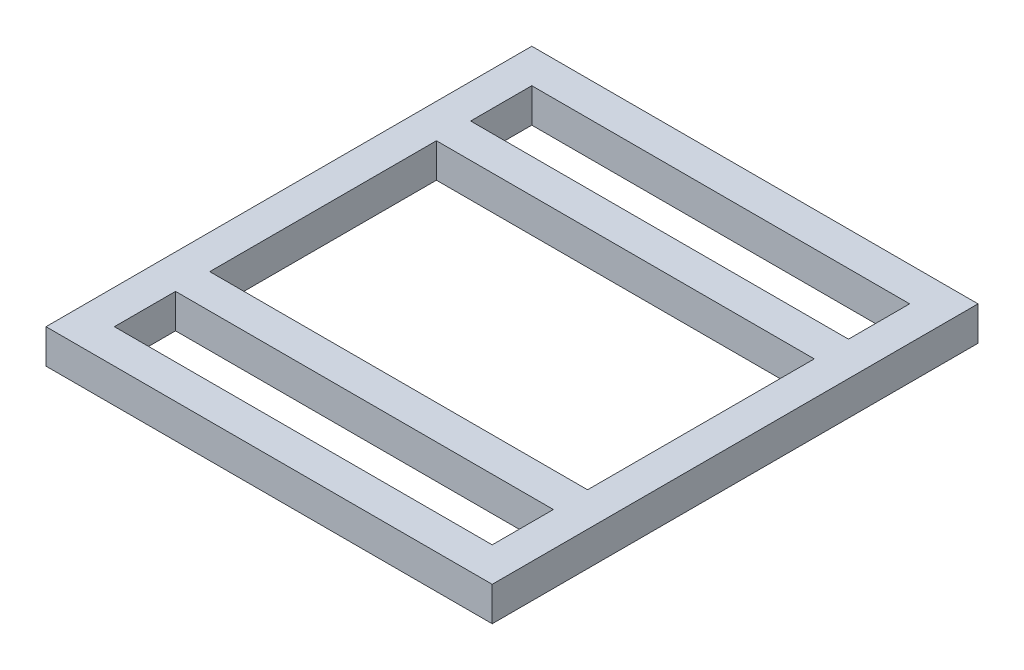
from build123d import *

# Parameters (mm, degrees)
SKETCH1_W           = 210
SKETCH1_H           = 34
SKETCH1_H_2         = 126
BOSS_EXTRUDE1_DEPTH = 19


with BuildPart() as part:
    # Sketch1 → Boss-Extrude1 (new body)
    with BuildSketch(Plane(origin=(0, 0, 0), x_dir=(1, 0, 0), z_dir=(0, 1, 0))):
        Polygon((-44.335030595, 191.764705882), (-44.335030595, -78.235294118), (-25.335030595, -78.235294118), (184.664969405, -78.235294118), (203.664969405, -78.235294118), (203.664969405, 191.764705882), (184.664969405, 191.764705882), (-25.335030595, 191.764705882), align=None)
        with Locations((79.664969405, -42.235294118)):
            Rectangle(SKETCH1_W, SKETCH1_H, mode=Mode.SUBTRACT)
        with Locations((79.664969405, 155.764705882)):
            Rectangle(SKETCH1_W, SKETCH1_H, mode=Mode.SUBTRACT)
        with Locations((79.664969405, 56.764705882)):
            Rectangle(SKETCH1_W, SKETCH1_H_2, mode=Mode.SUBTRACT)
    extrude(amount=BOSS_EXTRUDE1_DEPTH)


solid = part.part
